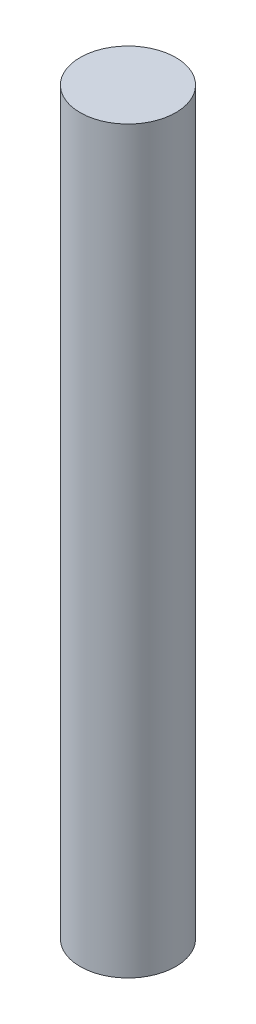
from build123d import *

# Parameters (mm, degrees)
SKETCH1_R           = 1.5
BOSS_EXTRUDE1_DEPTH = 23.2


with BuildPart() as part:
    # Sketch1 → Boss-Extrude1 (new body)
    with BuildSketch(Plane(origin=(0, 0, 0), x_dir=(1, 0, 0), z_dir=(0, 1, 0))):
        with Locations(Location((0, 0, 0), (0, 0, 270))):
            Circle(SKETCH1_R)
    extrude(amount=BOSS_EXTRUDE1_DEPTH)


solid = part.part
